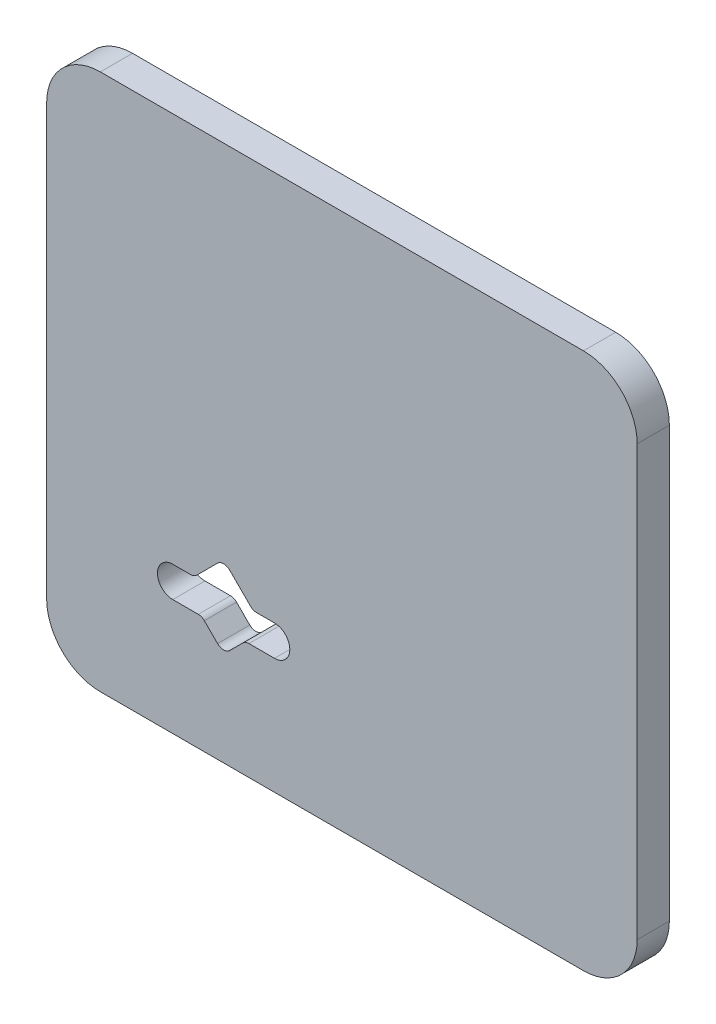
from build123d import *

# Parameters (mm, degrees)
EXTRUDE1_DEPTH = 3.81


with BuildPart() as part:
    # Sketch1 → Extrude1 (new body)
    with BuildSketch(Plane.XY):
        with BuildLine():
            Line((0, 10.36418202), (0, 61.16418202))
            ThreePointArc((0, 61.16418202), (1.859871939, 65.65431008), (6.35, 67.51418202))
            Line((6.35, 67.51418202), (63.5, 67.51418202))
            ThreePointArc((63.5, 67.51418202), (67.990128061, 65.65431008), (69.85, 61.16418202))
            Line((69.85, 61.16418202), (69.85, 10.36418202))
            ThreePointArc((69.85, 10.36418202), (67.990128061, 5.874053959), (63.5, 4.01418202))
            Line((63.5, 4.01418202), (6.35, 4.01418202))
            ThreePointArc((6.35, 4.01418202), (1.859871939, 5.874053959), (0, 10.36418202))
        make_face()
        with BuildLine():
            Line((24.833096834, 21.361626027), (26.952255854, 21.361626027))
            ThreePointArc((26.952255854, 21.361626027), (28.762066969, 19.551814912), (26.952255854, 17.742003797))
            Line((26.952255854, 17.742003797), (23.93028833, 17.742003797))
            ThreePointArc((23.93028833, 17.742003797), (23.541481963, 17.664665402), (23.211867841, 17.444424287))
            Line((23.211867841, 17.444424287), (21.65276114, 15.885317586))
            ThreePointArc((21.65276114, 15.885317586), (20.93434065, 15.587738076), (20.215920161, 15.885317586))
            Line((20.215920161, 15.885317586), (18.65681346, 17.444424287))
            ThreePointArc((18.65681346, 17.444424287), (18.327199337, 17.664665402), (17.93839297, 17.742003797))
            Line((17.93839297, 17.742003797), (14.916425446, 17.742003797))
            ThreePointArc((14.916425446, 17.742003797), (13.106614331, 19.551814912), (14.916425446, 21.361626027))
            Line((14.916425446, 21.361626027), (17.035584467, 21.361626027))
            ThreePointArc((17.035584467, 21.361626027), (17.424390834, 21.438964422), (17.754004956, 21.659205538))
            Line((17.754004956, 21.659205538), (20.215920161, 24.121120742))
            ThreePointArc((20.215920161, 24.121120742), (20.93434065, 24.418700252), (21.65276114, 24.121120742))
            Line((21.65276114, 24.121120742), (24.114676344, 21.659205538))
            ThreePointArc((24.114676344, 21.659205538), (24.444290467, 21.438964422), (24.833096834, 21.361626027))
        make_face(mode=Mode.SUBTRACT)
    extrude(amount=-EXTRUDE1_DEPTH)


solid = part.part
